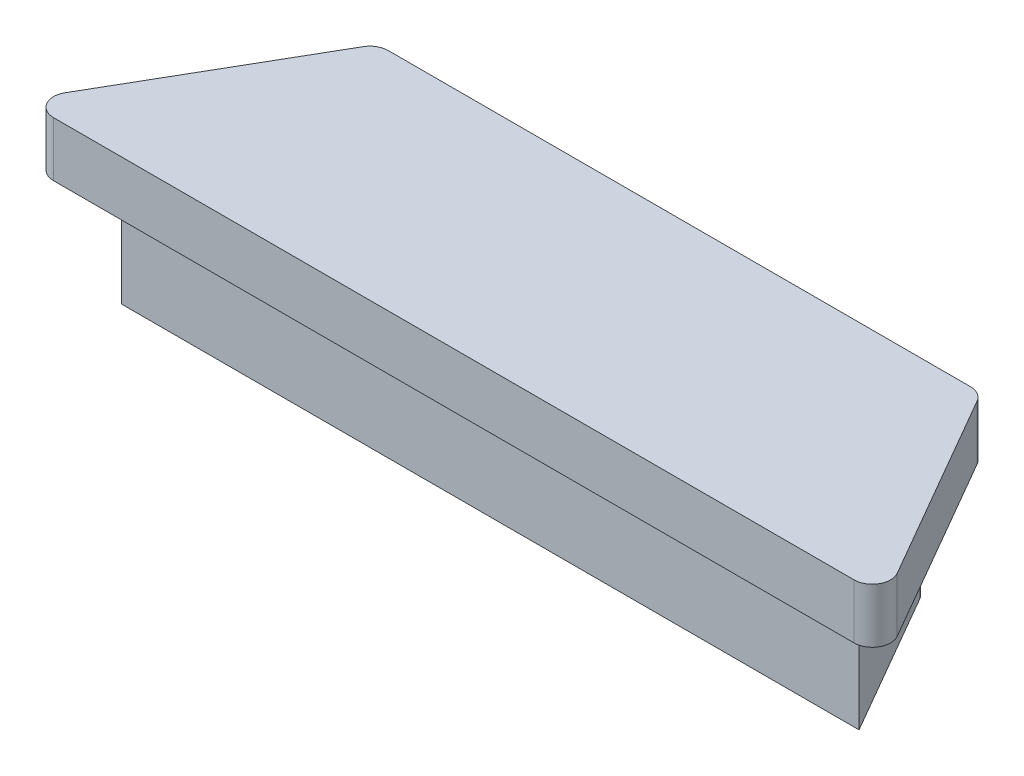
from build123d import *

# Parameters (mm, degrees)
BOSS_EXTRUDE1_DEPTH = 6
BOSS_EXTRUDE2_DEPTH = 3


with BuildPart() as part:
    # Sketch1 → Boss-Extrude1 (new body)
    with BuildSketch(Plane(origin=(0, 0, 0), x_dir=(1, 0, 0), z_dir=(0, 1, 0))):
        with BuildLine():
            Line((-21.042961381, 71.822608989), (-50.715055762, 71.822608989))
            ThreePointArc((-50.715055762, 71.822608989), (-51.215055762, 71.688634393), (-51.581081166, 71.322608989))
            Line((-51.581081166, 71.322608989), (-56.132737248, 63.438909397))
            Line((-56.132737248, 63.438909397), (-15.625279896, 63.438909397))
            Line((-15.625279896, 63.438909397), (-20.176935977, 71.322608989))
            ThreePointArc((-20.176935977, 71.322608989), (-20.542961381, 71.688634393), (-21.042961381, 71.822608989))
        make_face()
    extrude(amount=BOSS_EXTRUDE1_DEPTH)

    # Sketch2 → Boss-Extrude2 (add)
    with BuildSketch(Plane(origin=(0, 6, 0), x_dir=(1, 0, 0), z_dir=(0, 1, 0))):
        with BuildLine():
            Line((-13.893229088, 61.438909397), (-57.864788055, 61.438909397))
            ThreePointArc((-57.864788055, 61.438909397), (-58.730813459, 61.938909397), (-58.730813459, 62.938909397))
            Line((-58.730813459, 62.938909397), (-52.735781704, 73.322608989))
            ThreePointArc((-52.735781704, 73.322608989), (-52.3697563, 73.688634393), (-51.8697563, 73.822608989))
            Line((-51.8697563, 73.822608989), (-19.888260843, 73.822608989))
            ThreePointArc((-19.888260843, 73.822608989), (-19.388260843, 73.688634393), (-19.022235439, 73.322608989))
            Line((-19.022235439, 73.322608989), (-13.027203684, 62.938909397))
            ThreePointArc((-13.027203684, 62.938909397), (-13.027203684, 61.938909397), (-13.893229088, 61.438909397))
        make_face()
    extrude(amount=BOSS_EXTRUDE2_DEPTH)


solid = part.part
